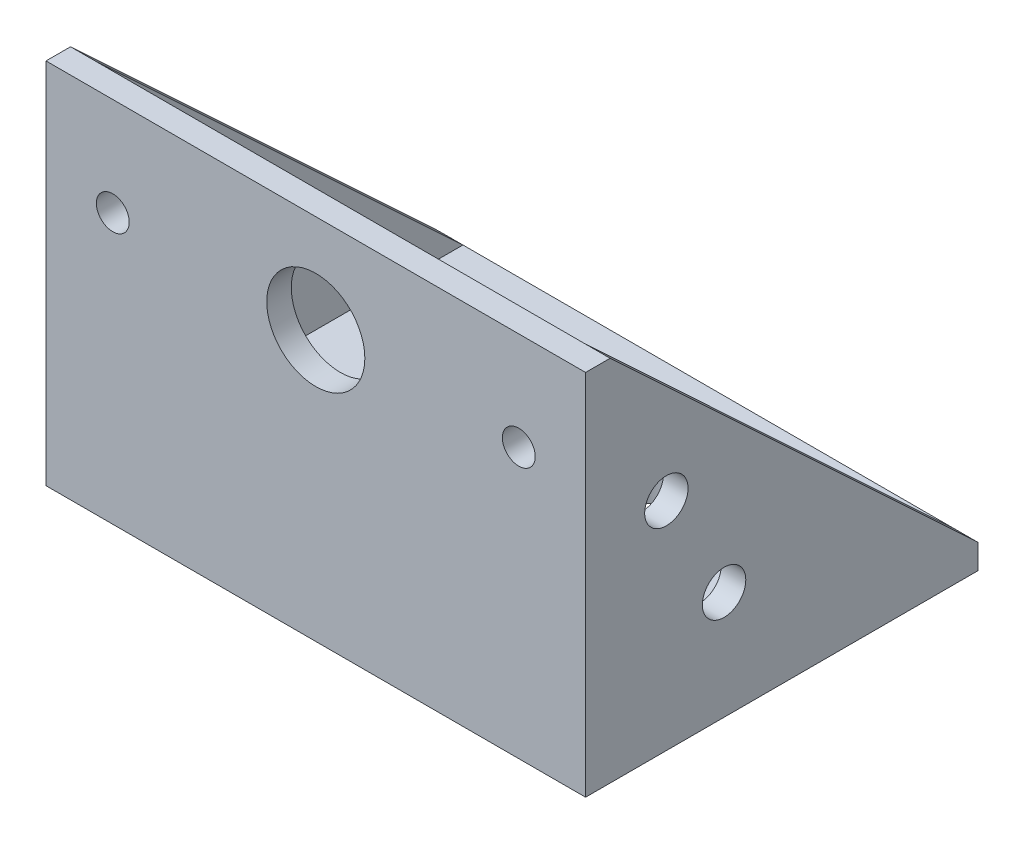
from build123d import *

# Parameters (mm, degrees)
SKETCH1_W           = 50.8
SKETCH1_H           = 38.1
SKETCH1_R           = 2.2479
BOSS_EXTRUDE1_DEPTH = 2.54
SKETCH4_W           = 50.8
SKETCH4_H           = 38.1
SKETCH4_R           = 5.08
SKETCH4_R_2         = 1.7018
BOSS_EXTRUDE2_DEPTH = 2.54
SKETCH5_R           = 2.2479
BOSS_EXTRUDE3_DEPTH = 2.54
BOSS_EXTRUDE4_START = 2.54
SKETCH6_R           = 2.25933
SKETCH6_R_2         = 2.2479
BOSS_EXTRUDE4_DEPTH = 2.54


with BuildPart() as part:
    # Sketch1 → Boss-Extrude1 (new body)
    with BuildSketch(Plane(origin=(0, 0, 0), x_dir=(1, 0, 0), z_dir=(0, 1, 0))):
        with Locations((25.4, 19.05)):
            Rectangle(SKETCH1_W, SKETCH1_H)
        with Locations(Location((6.35, 25.4, 0), (0, 0, 270))):
            Circle(SKETCH1_R, mode=Mode.SUBTRACT)
        with Locations(Location((19.05, 25.4, 0), (0, 0, 270))):
            Circle(SKETCH1_R, mode=Mode.SUBTRACT)
        with Locations(Location((31.75, 25.4, 0), (0, 0, 270))):
            Circle(SKETCH1_R, mode=Mode.SUBTRACT)
        with Locations(Location((44.45, 25.4, 0), (0, 0, 270))):
            Circle(SKETCH1_R, mode=Mode.SUBTRACT)
    extrude(amount=-BOSS_EXTRUDE1_DEPTH)

    # Sketch4 → Boss-Extrude2 (add)
    with BuildSketch(Plane.XY):
        with Locations((25.4, 16.51)):
            Rectangle(SKETCH4_W, SKETCH4_H)
        with Locations((25.4, 25.4)):
            Circle(SKETCH4_R, mode=Mode.SUBTRACT)
        with Locations((4.37642, 25.4)):
            Circle(SKETCH4_R_2, mode=Mode.SUBTRACT)
        with Locations((46.42358, 25.4)):
            Circle(SKETCH4_R_2, mode=Mode.SUBTRACT)
    extrude(amount=BOSS_EXTRUDE2_DEPTH)

    # Sketch5 → Boss-Extrude3 (add)
    with BuildSketch(Plane(origin=(50.8, 0, 0), x_dir=(0, 0, -1), z_dir=(1, 0, 0))):
        Polygon((0, 35.56), (-2.54, 35.56), (-2.54, -2.54), (38.1, -2.54), (38.1, 0), align=None)
        with Locations((11.803529412, 8.665882353)):
            Circle(SKETCH5_R, mode=Mode.SUBTRACT)
        with Locations((5.827058824, 19.871764706)):
            Circle(SKETCH5_R, mode=Mode.SUBTRACT)
    extrude(amount=BOSS_EXTRUDE3_DEPTH)

    # Sketch6 → Boss-Extrude4 (add)
    with BuildSketch(Plane.ZY.offset(BOSS_EXTRUDE4_START)):
        Polygon((0, 35.56), (-38.1, 0), (-38.1, -2.54), (2.54, -2.54), (2.54, 35.56), align=None)
        with Locations((-11.803529412, 8.665882353)):
            Circle(SKETCH6_R, mode=Mode.SUBTRACT)
        with Locations(Location((-5.827058824, 19.871764706, 0), (0, 0, 180))):
            Circle(SKETCH6_R_2, mode=Mode.SUBTRACT)
    extrude(amount=-BOSS_EXTRUDE4_DEPTH)


solid = part.part
